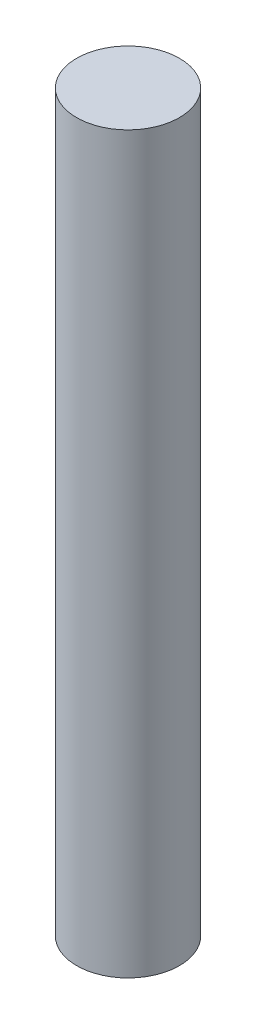
from build123d import *

# Parameters (mm, degrees)
SKETCH1_R           = 10.668
BOSS_EXTRUDE1_DEPTH = 152.4


with BuildPart() as part:
    # Sketch1 → Boss-Extrude1 (new body)
    with BuildSketch(Plane(origin=(0, 0, 0), x_dir=(1, 0, 0), z_dir=(0, 1, 0))):
        with Locations(Location((0, 0, 0), (0, 0, 90))):
            Circle(SKETCH1_R)
    extrude(amount=BOSS_EXTRUDE1_DEPTH)


solid = part.part
